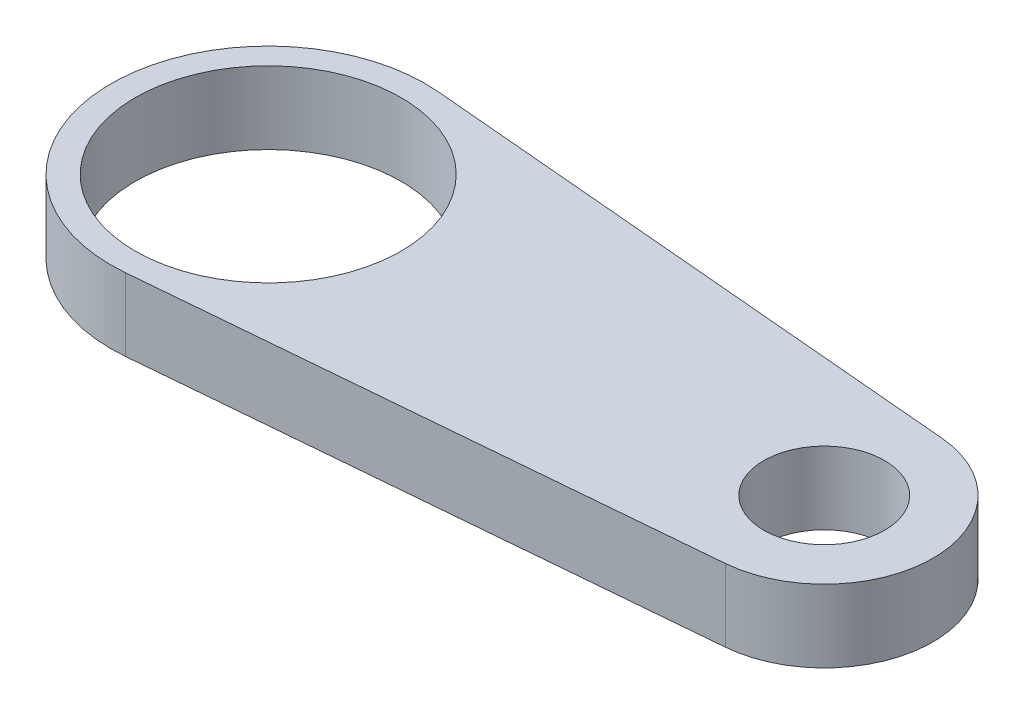
from build123d import *

# Parameters (mm, degrees)
SKETCH1_R           = 22
SKETCH1_R_2         = 10
BOSS_EXTRUDE1_DEPTH = 12


with BuildPart() as part:
    # Sketch1 → Boss-Extrude1 (new body)
    with BuildSketch(Plane(origin=(0, 0, 0), x_dir=(1, 0, 0), z_dir=(0, 1, 0))):
        with BuildLine():
            Line((2.260869565, 25.901514798), (93.565217391, 17.931817937))
            ThreePointArc((93.565217391, 17.931817937), (110, 0), (93.565217391, -17.931817937))
            Line((93.565217391, -17.931817937), (2.260869565, -25.901514798))
            ThreePointArc((2.260869565, -25.901514798), (-26, 0), (2.260869565, 25.901514798))
        make_face()
        with Locations(Location((0, 0, 0), (0, 0, 270))):
            Circle(SKETCH1_R, mode=Mode.SUBTRACT)
        with Locations(Location((92, 0, 0), (0, 0, 270))):
            Circle(SKETCH1_R_2, mode=Mode.SUBTRACT)
    extrude(amount=BOSS_EXTRUDE1_DEPTH)


solid = part.part
